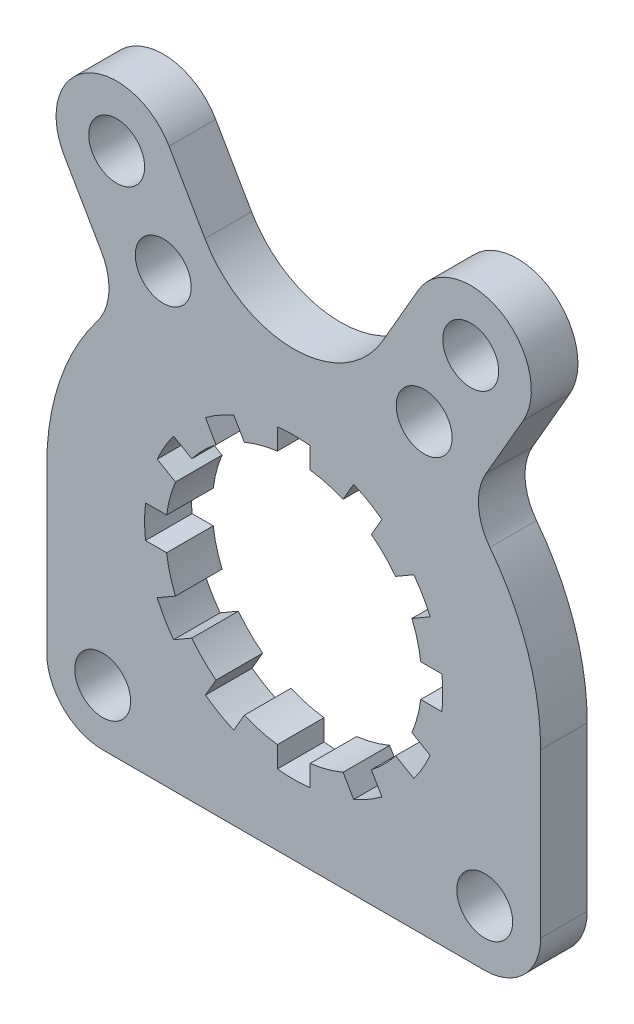
from build123d import *

# Parameters (mm, degrees)
CROQUIS1_R              = 6
CROQUIS1_R_2            = 41
SALIENTE_EXTRUIR1_DEPTH = 10


with BuildPart() as part:
    # Croquis1 → Saliente-Extruir1 (new body)
    # profile 1 of 2: a face of its own
    with BuildSketch(Plane.XY):
        with BuildLine():
            ThreePointArc((49.258330249, 59.317930688), (44.5, 77.076260937), (26.741669751, 72.317930688))
            Line((26.741669751, 72.317930688), (19.052558883, 59))
            ThreePointArc((19.052558883, 59), (0, 48), (-19.052558883, 59))
            Line((-19.052558883, 59), (-26.741669751, 72.317930688))
            ThreePointArc((-26.741669751, 72.317930688), (-44.5, 77.076260937), (-49.258330249, 59.317930688))
            Line((-49.258330249, 59.317930688), (-41.258335188, 45.461532781))
            ThreePointArc((-41.258335188, 45.461532781), (-39.675518573, 38.68922066), (-42.115138595, 32.176327751))
            ThreePointArc((-42.115138595, 32.176327751), (-50.205097588, 16.983790583), (-53, 0))
            Line((-53, 0), (-53, -35))
            ThreePointArc((-53, -35), (-49.485281374, -43.485281374), (-41, -47))
            Line((-41, -47), (-9.521486782, -47))
            Line((-9.521486782, -47), (9.521486782, -47))
            Line((9.521486782, -47), (41, -47))
            ThreePointArc((41, -47), (49.485281374, -43.485281374), (53, -35))
            Line((53, -35), (53, 0))
            ThreePointArc((53, 0), (50.205097588, 16.983790583), (42.115138595, 32.176327751))
            ThreePointArc((42.115138595, 32.176327751), (39.675518573, 38.68922066), (41.258335188, 45.461532781))
            Line((41.258335188, 45.461532781), (49.258330249, 59.317930688))
        make_face()
        with Locations((-41, -35)):
            Circle(CROQUIS1_R, mode=Mode.SUBTRACT)
        with Locations((41, -35)):
            Circle(CROQUIS1_R, mode=Mode.SUBTRACT)
        Circle(CROQUIS1_R_2, mode=Mode.SUBTRACT)
        with Locations((-28, 48.497422612)):
            Circle(CROQUIS1_R, mode=Mode.SUBTRACT)
        with Locations((-38, 65.817930688)):
            Circle(CROQUIS1_R, mode=Mode.SUBTRACT)
        with Locations((28, 48.497422612)):
            Circle(CROQUIS1_R, mode=Mode.SUBTRACT)
        with Locations((38, 65.817930688)):
            Circle(CROQUIS1_R, mode=Mode.SUBTRACT)
    # profile 2 of 2: a face of its own
    with BuildSketch(Plane.XY):
        Circle(CROQUIS1_R_2)
        with BuildLine():
            ThreePointArc((10.607092784, 25.372023622), (7.11752374, 26.562960223), (3.5, 27.276363394))
            Line((3.5, 27.276363394), (3.5, 31.808017857))
            ThreePointArc((3.5, 31.808017857), (0, 32), (-3.5, 31.808017857))
            Line((-3.5, 31.808017857), (-3.5, 27.276363394))
            ThreePointArc((-3.5, 27.276363394), (-7.11752374, 26.562960223), (-10.607092784, 25.372023622))
            Line((-10.607092784, 25.372023622), (-12.872920015, 29.296551508))
            ThreePointArc((-12.872920015, 29.296551508), (-16, 27.712812921), (-18.935097842, 25.796551508))
            Line((-18.935097842, 25.796551508), (-16.66927061, 21.872023622))
            ThreePointArc((-16.66927061, 21.872023622), (-19.445436483, 19.445436483), (-21.872023622, 16.66927061))
            Line((-21.872023622, 16.66927061), (-25.796551508, 18.935097842))
            ThreePointArc((-25.796551508, 18.935097842), (-27.712812921, 16), (-29.296551508, 12.872920015))
            Line((-29.296551508, 12.872920015), (-25.372023622, 10.607092784))
            ThreePointArc((-25.372023622, 10.607092784), (-26.562960223, 7.11752374), (-27.276363394, 3.5))
            Line((-27.276363394, 3.5), (-31.808017857, 3.5))
            ThreePointArc((-31.808017857, 3.5), (-32, 0), (-31.808017857, -3.5))
            Line((-31.808017857, -3.5), (-27.276363394, -3.5))
            ThreePointArc((-27.276363394, -3.5), (-26.562960223, -7.11752374), (-25.372023622, -10.607092784))
            Line((-25.372023622, -10.607092784), (-29.296551508, -12.872920015))
            ThreePointArc((-29.296551508, -12.872920015), (-27.712812921, -16), (-25.796551508, -18.935097842))
            Line((-25.796551508, -18.935097842), (-21.872023622, -16.66927061))
            ThreePointArc((-21.872023622, -16.66927061), (-19.445436483, -19.445436483), (-16.66927061, -21.872023622))
            Line((-16.66927061, -21.872023622), (-18.935097842, -25.796551508))
            ThreePointArc((-18.935097842, -25.796551508), (-16, -27.712812921), (-12.872920015, -29.296551508))
            Line((-12.872920015, -29.296551508), (-10.607092784, -25.372023622))
            ThreePointArc((-10.607092784, -25.372023622), (-7.11752374, -26.562960223), (-3.5, -27.276363394))
            Line((-3.5, -27.276363394), (-3.5, -31.808017857))
            ThreePointArc((-3.5, -31.808017857), (0, -32), (3.5, -31.808017857))
            Line((3.5, -31.808017857), (3.5, -27.276363394))
            ThreePointArc((3.5, -27.276363394), (7.11752374, -26.562960223), (10.607092784, -25.372023622))
            Line((10.607092784, -25.372023622), (12.872920015, -29.296551508))
            ThreePointArc((12.872920015, -29.296551508), (16, -27.712812921), (18.935097842, -25.796551508))
            Line((18.935097842, -25.796551508), (16.66927061, -21.872023622))
            ThreePointArc((16.66927061, -21.872023622), (19.445436483, -19.445436483), (21.872023622, -16.66927061))
            Line((21.872023622, -16.66927061), (25.796551508, -18.935097842))
            ThreePointArc((25.796551508, -18.935097842), (27.712812921, -16), (29.296551508, -12.872920015))
            Line((29.296551508, -12.872920015), (25.372023622, -10.607092784))
            ThreePointArc((25.372023622, -10.607092784), (26.562960223, -7.11752374), (27.276363394, -3.5))
            Line((27.276363394, -3.5), (31.808017857, -3.5))
            ThreePointArc((31.808017857, -3.5), (32, 0), (31.808017857, 3.5))
            Line((31.808017857, 3.5), (27.276363394, 3.5))
            ThreePointArc((27.276363394, 3.5), (26.562960223, 7.11752374), (25.372023622, 10.607092784))
            Line((25.372023622, 10.607092784), (29.296551508, 12.872920015))
            ThreePointArc((29.296551508, 12.872920015), (27.712812921, 16), (25.796551508, 18.935097842))
            Line((25.796551508, 18.935097842), (21.872023622, 16.66927061))
            ThreePointArc((21.872023622, 16.66927061), (19.445436483, 19.445436483), (16.66927061, 21.872023622))
            Line((16.66927061, 21.872023622), (18.935097842, 25.796551508))
            ThreePointArc((18.935097842, 25.796551508), (16, 27.712812921), (12.872920015, 29.296551508))
            Line((12.872920015, 29.296551508), (10.607092784, 25.372023622))
        make_face(mode=Mode.SUBTRACT)
    extrude(amount=SALIENTE_EXTRUIR1_DEPTH)


solid = part.part
